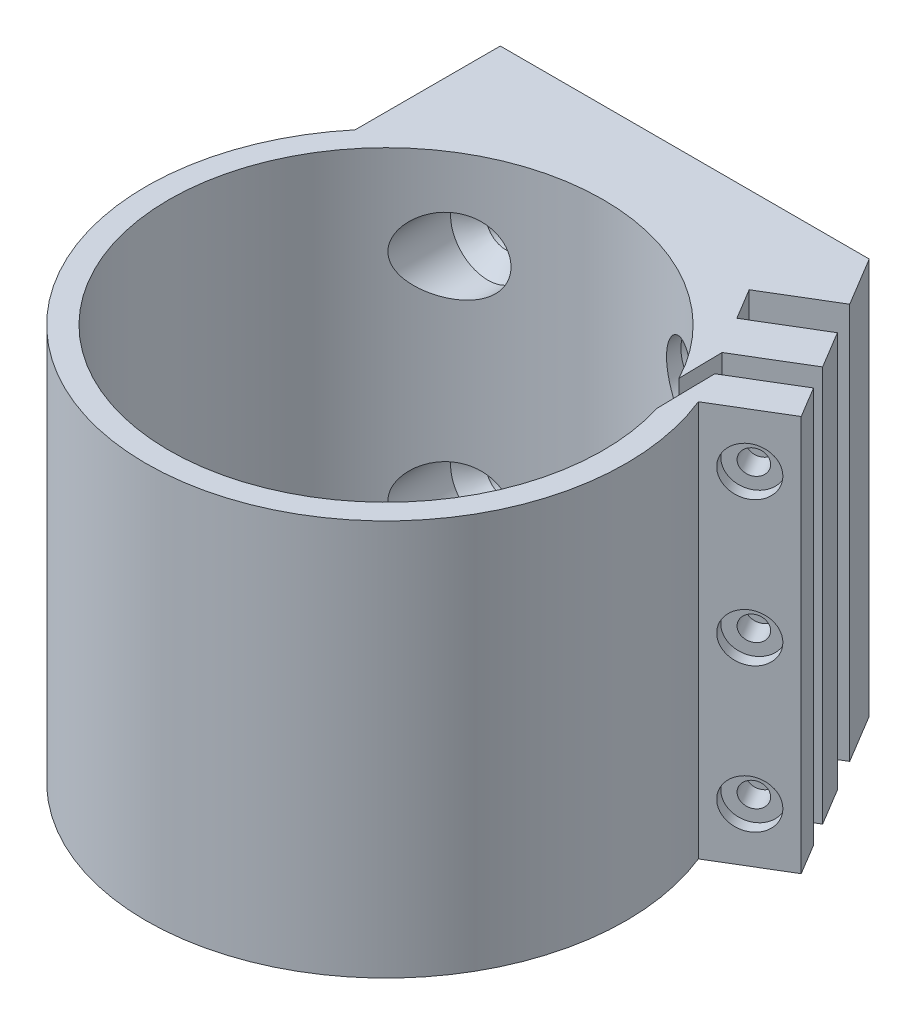
from build123d import *

# Parameters (mm, degrees)
BOSS_EXTRUDE1_DEPTH                            = 27.5
CBORE_FOR_M3_SBHCS1_D                          = 3.4
CBORE_FOR_M3_SBHCS1_DEPTH                      = 20.0000108
CBORE_FOR_M3_SBHCS1_CBORE_D                    = 6.7
CBORE_FOR_M3_SBHCS1_CBORE_DEPTH                = 1.65
CBORE_FOR_M3_SBHCS1_TIP                        = 1.021463052
SKETCH4_W                                      = 41.25
SKETCH4_H                                      = 6.157842489
BOSS_EXTRUDE2_DEPTH                            = 4.5
CSK_FOR_M5_FLAT_HEAD_MACHINE_SCREW1_AT_2_COUNT = 2
CSK_FOR_M5_FLAT_HEAD_MACHINE_SCREW1_AT_2_PITCH = 32
CSK_FOR_M5_FLAT_HEAD_MACHINE_SCREW1_AT_3_COUNT = 2
CSK_FOR_M5_FLAT_HEAD_MACHINE_SCREW1_AT_3_PITCH = 43.863424399
CSK_FOR_M5_FLAT_HEAD_MACHINE_SCREW1_AT_4_COUNT = 2
CSK_FOR_M5_FLAT_HEAD_MACHINE_SCREW1_AT_4_PITCH = 30
CUT_EXTRUDE1_REACH                             = 81.852
CUT_EXTRUDE1_END_RADIUS                        = 30.1625
SKETCH13_R                                     = 5.2


with BuildPart() as part:
    # Sketch1 → Boss-Extrude1 (new, symmetric)
    with BuildSketch(Plane(origin=(0, 0, 0), x_dir=(1, 0, 0), z_dir=(0, 1, 0))):
        with BuildLine():
            Line((-25.625, 41.495342489), (-25.625, 21.324827813))
            ThreePointArc((-25.625, 21.324827813), (-5.163493362, -32.935197624), (30.921632796, 12.45959596))
            Line((30.921632796, 12.45959596), (39.848528412, 17.823415986))
            Line((39.848528412, 17.823415986), (37.273338038, 22.109252489))
            Line((37.273338038, 22.109252489), (28.701665031, 16.95887174))
            Line((28.701665031, 16.95887174), (28.843705147, 8.821398963))
            ThreePointArc((28.843705147, 8.821398963), (-27.915992451, -11.422511622), (26.75426667, 13.927872098))
            Line((26.75426667, 13.927872098), (26.647715613, 20.032178086))
            Line((26.647715613, 20.032178086), (35.371714531, 25.274085476))
            Line((35.371714531, 25.274085476), (32.281486081, 30.41708928))
            Line((32.281486081, 30.41708928), (23.557487163, 25.17518189))
            Line((23.557487163, 25.17518189), (20.982296789, 29.461018394))
            Line((20.982296789, 29.461018394), (29.706295707, 34.702925784))
            Line((29.706295707, 34.702925784), (25.625, 41.495342489))
            Line((25.625, 41.495342489), (20.625, 41.495342489))
            Line((20.625, 41.495342489), (20.625, 35.3375))
            Line((20.625, 35.3375), (-20.625, 35.3375))
            Line((-20.625, 35.3375), (-20.625, 41.495342489))
            Line((-20.625, 41.495342489), (-25.625, 41.495342489))
        make_face()
    extrude(amount=BOSS_EXTRUDE1_DEPTH, both=True)

    # CBORE for M3 SBHCS1
    with Locations(Plane(origin=(2.701817631, 0, 4.496579649), x_dir=(0.8571673007021098, 0, -0.5150380749100585), z_dir=(0.5150380749100585, 0, 0.8571673007021098))):
        with Locations((38.129386114, 20), (38.129386114, 0), (38.129386114, -20)):
            CounterBoreHole(CBORE_FOR_M3_SBHCS1_D / 2, CBORE_FOR_M3_SBHCS1_CBORE_D / 2, CBORE_FOR_M3_SBHCS1_CBORE_DEPTH, depth=CBORE_FOR_M3_SBHCS1_DEPTH)
            with Locations((0, 0, -(CBORE_FOR_M3_SBHCS1_DEPTH + CBORE_FOR_M3_SBHCS1_TIP / 2))):  # 118° drill point
                Cone(0, CBORE_FOR_M3_SBHCS1_D / 2, CBORE_FOR_M3_SBHCS1_TIP, mode=Mode.SUBTRACT)

    # Sketch4 → Boss-Extrude2 (add)
    with BuildSketch(Plane.XZ.offset(-27.5)):
        with Locations((0, -38.416421245)):
            Rectangle(SKETCH4_W, SKETCH4_H)
    extrude(amount=BOSS_EXTRUDE2_DEPTH)

    # Sketch12 → CSK for M5 Flat Head Machine Screw1 (revolve, cut)
    with BuildSketch(Plane(origin=(-16, 15, -30.1625), x_dir=(0, -1, 0), z_dir=(1, 0, 0))):
        Polygon((0, 0), (0, 11.332842489), (2.75, 11.332842489), (2.75, 2.45), (5.2, 0), align=None)
    csk_for_m5_flat_head_machine_screw1 = revolve(axis=Axis((-16, 15, -23.8125), (0, 0, -1)), mode=Mode.SUBTRACT)

    # CSK for M5 Flat Head Machine Screw1 at 2: CSK for M5 Flat Head Machine Screw1 ×2
    with Locations(*[(i * CSK_FOR_M5_FLAT_HEAD_MACHINE_SCREW1_AT_2_PITCH, 0, 0) for i in range(1, CSK_FOR_M5_FLAT_HEAD_MACHINE_SCREW1_AT_2_COUNT)]):
        add(csk_for_m5_flat_head_machine_screw1, mode=Mode.SUBTRACT)

    # CSK for M5 Flat Head Machine Screw1 at 3: CSK for M5 Flat Head Machine Screw1 ×2
    with Locations(*[Vector(0.7295372041400853, -0.6839411288813297, 0) * (i * CSK_FOR_M5_FLAT_HEAD_MACHINE_SCREW1_AT_3_PITCH) for i in range(1, CSK_FOR_M5_FLAT_HEAD_MACHINE_SCREW1_AT_3_COUNT)]):
        add(csk_for_m5_flat_head_machine_screw1, mode=Mode.SUBTRACT)

    # CSK for M5 Flat Head Machine Screw1 at 4: CSK for M5 Flat Head Machine Screw1 ×2
    with Locations(*[(0, -i * CSK_FOR_M5_FLAT_HEAD_MACHINE_SCREW1_AT_4_PITCH, 0) for i in range(1, CSK_FOR_M5_FLAT_HEAD_MACHINE_SCREW1_AT_4_COUNT)]):
        add(csk_for_m5_flat_head_machine_screw1, mode=Mode.SUBTRACT)

    # Cut-Extrude1: up to this cylinder (the profile starts outside it)
    cut_extrude1_end = Plane(origin=(0, 0, 0), z_dir=(0, -1, 0)) * Cylinder(CUT_EXTRUDE1_END_RADIUS, 255.029, mode=Mode.PRIVATE)
    # Sketch13 → Cut-Extrude1 (cut, up to the surface)
    with BuildSketch(Plane.XY.offset(-30.1625), mode=Mode.PRIVATE) as cut_extrude1_sk1:
        with Locations(Location((-16, -15, 0), (0, 0, 180))):
            Circle(SKETCH13_R)
    cut_extrude1_tool1 = extrude(cut_extrude1_sk1.sketch, amount=CUT_EXTRUDE1_REACH, mode=Mode.PRIVATE) - cut_extrude1_end
    add(cut_extrude1_tool1.solids().sort_by_distance((-16, -15, -30.1625))[0], mode=Mode.SUBTRACT)
    # Sketch13 → Cut-Extrude1 (cut, up to the surface)
    with BuildSketch(Plane.XY.offset(-30.1625), mode=Mode.PRIVATE) as cut_extrude1_sk2:
        with Locations(Location((16, -15, 0), (0, 0, 180))):
            Circle(SKETCH13_R)
    cut_extrude1_tool2 = extrude(cut_extrude1_sk2.sketch, amount=CUT_EXTRUDE1_REACH, mode=Mode.PRIVATE) - cut_extrude1_end
    add(cut_extrude1_tool2.solids().sort_by_distance((16, -15, -30.1625))[0], mode=Mode.SUBTRACT)
    # Sketch13 → Cut-Extrude1 (cut, up to the surface)
    with BuildSketch(Plane.XY.offset(-30.1625), mode=Mode.PRIVATE) as cut_extrude1_sk3:
        with Locations(Location((16, 15, 0), (0, 0, 180))):
            Circle(SKETCH13_R)
    cut_extrude1_tool3 = extrude(cut_extrude1_sk3.sketch, amount=CUT_EXTRUDE1_REACH, mode=Mode.PRIVATE) - cut_extrude1_end
    add(cut_extrude1_tool3.solids().sort_by_distance((16, 15, -30.1625))[0], mode=Mode.SUBTRACT)
    # Sketch13 → Cut-Extrude1 (cut, up to the surface)
    with BuildSketch(Plane.XY.offset(-30.1625), mode=Mode.PRIVATE) as cut_extrude1_sk4:
        with Locations(Location((-16, 15, 0), (0, 0, 180))):
            Circle(SKETCH13_R)
    cut_extrude1_tool4 = extrude(cut_extrude1_sk4.sketch, amount=CUT_EXTRUDE1_REACH, mode=Mode.PRIVATE) - cut_extrude1_end
    add(cut_extrude1_tool4.solids().sort_by_distance((-16, 15, -30.1625))[0], mode=Mode.SUBTRACT)


solid = part.part
